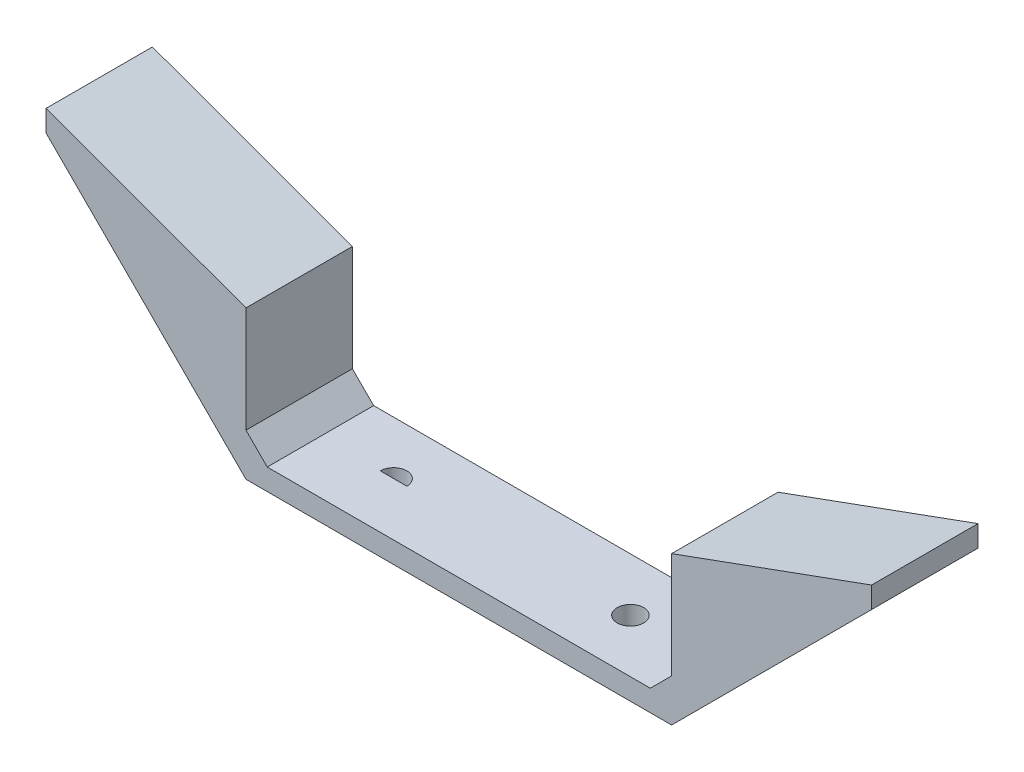
from build123d import *

# Parameters (mm, degrees)
BOSS_EXTRUDE1_DEPTH = 12.7
CUT_EXTRUDE1_REACH  = 58.199
SKETCH2_R           = 1.5875


with BuildPart() as part:
    # Sketch1 → Boss-Extrude1 (new body)
    with BuildSketch(Plane.XY):
        Polygon((25.4, 0), (49.268192568, 23.868192568), (49.268192568, 26.408192568), (25.4, 17.720880927), (25.4, 5.08), (22.86, 2.54), (0, 2.54), (0, 0), align=None)
    boss_extrude1 = extrude(amount=BOSS_EXTRUDE1_DEPTH)

    # Mirror1: Boss-Extrude1 across plane
    add(boss_extrude1.mirror(Plane(origin=(0, 0, 12.7), x_dir=(0, 0, 1), z_dir=(1, 0, 0))))

    # Sketch2 → Cut-Extrude1 (cut, up to next)
    with BuildSketch(Plane(origin=(0, 2.54, 0), x_dir=(1, 0, 0), z_dir=(0, 1, 0)), mode=Mode.PRIVATE) as cut_extrude1_sk1:
        with BuildLine():
            ThreePointArc((-12.550350762, -6.35), (-14.137850762, -4.7625), (-15.725350762, -6.35))
            Line((-15.725350762, -6.35), (-12.550350762, -6.35))
        make_face()
    cut_extrude1_tool1 = extrude(cut_extrude1_sk1.sketch, amount=-CUT_EXTRUDE1_REACH, mode=Mode.PRIVATE) & part.part
    # Sketch2 → Cut-Extrude1 (cut, up to next)
    with BuildSketch(Plane(origin=(0, 2.54, 0), x_dir=(1, 0, 0), z_dir=(0, 1, 0)), mode=Mode.PRIVATE) as cut_extrude1_sk2:
        with Locations(Location((14.137850762, -6.35, 0), (0, 0, 270))):
            Circle(SKETCH2_R)
    cut_extrude1_tool2 = extrude(cut_extrude1_sk2.sketch, amount=-CUT_EXTRUDE1_REACH, mode=Mode.PRIVATE) & part.part
    add(cut_extrude1_tool1.solids().sort_by_distance((-14.137851, 2.54, 5.676244))[0], mode=Mode.SUBTRACT)
    add(cut_extrude1_tool2.solids().sort_by_distance((14.137851, 2.54, 6.35))[0], mode=Mode.SUBTRACT)


solid = part.part
